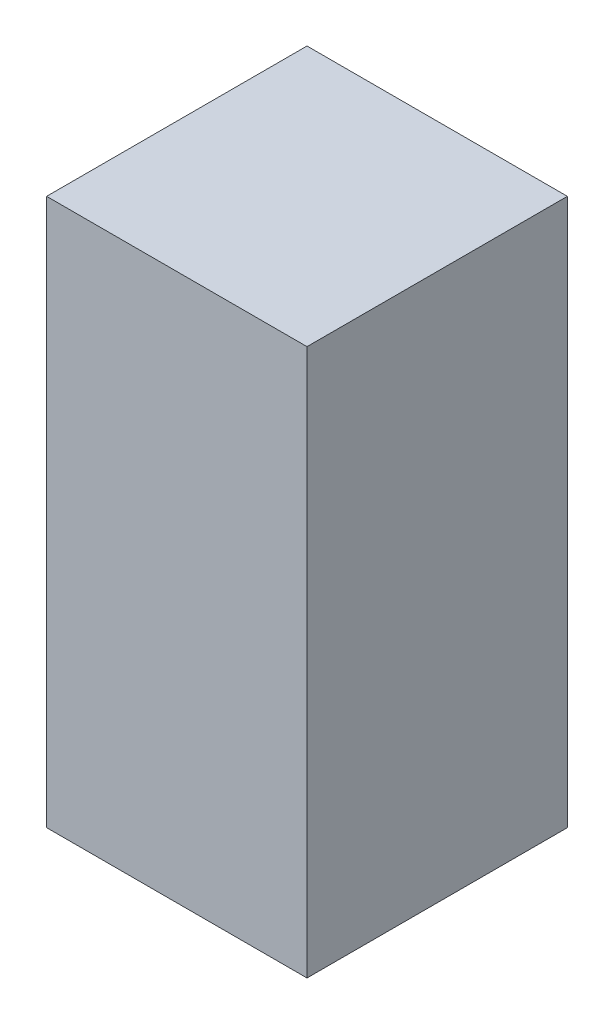
from build123d import *

# Parameters (mm, degrees)
SKETCH1_W           = 100
SKETCH1_H           = 210
BOSS_EXTRUDE1_DEPTH = 100


with BuildPart() as part:
    # Sketch1 → Boss-Extrude1 (new body)
    with BuildSketch(Plane.XY):
        with Locations((50, 105)):
            Rectangle(SKETCH1_W, SKETCH1_H)
    extrude(amount=BOSS_EXTRUDE1_DEPTH)


solid = part.part
